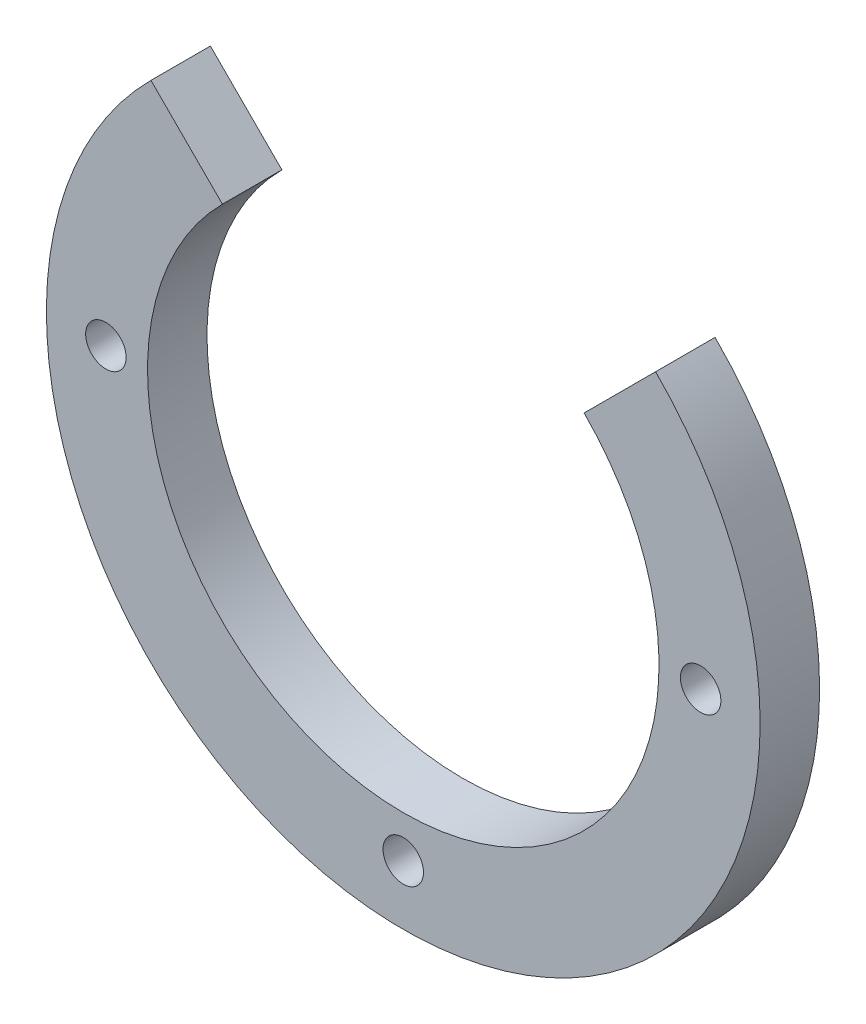
from build123d import *

# Parameters (mm, degrees)
SKETCH_1_R              = 30
SKETCH_1_R_2            = 21.5
EXTRUDE_1_DEPTH         = 5
HOLE_WIZARD_3_4_3_4_1_D = 3.4
CUT_EXTRUDE_1_DEPTH     = 43.720018727


with BuildPart() as part:
    # 草图1 → 凸台-拉伸1 (new body)
    with BuildSketch(Plane.XY):
        Circle(SKETCH_1_R)
        Circle(SKETCH_1_R_2, mode=Mode.SUBTRACT)
    extrude(amount=EXTRUDE_1_DEPTH)

    # Ø3.4 (3.4) 直径孔1 (through all)
    with Locations(Plane(origin=(-25, 0, 5), x_dir=(1, 0, 0), z_dir=(0, 0, 1))):
        with Locations((0, 0), (25, 25), (25, -25), (50, 0)):
            Hole(HOLE_WIZARD_3_4_3_4_1_D / 2)

    # 草图4 → 切除-拉伸1 (cut, through all)
    with BuildSketch(Plane.XY.offset(5)):
        with BuildLine():
            Line((0, 0), (-21.213203436, 21.213203436))
            ThreePointArc((-21.213203436, 21.213203436), (0, 30), (21.213203436, 21.213203436))
            Line((21.213203436, 21.213203436), (0, 0))
        make_face()
    extrude(amount=-CUT_EXTRUDE_1_DEPTH, mode=Mode.SUBTRACT)


solid = part.part
